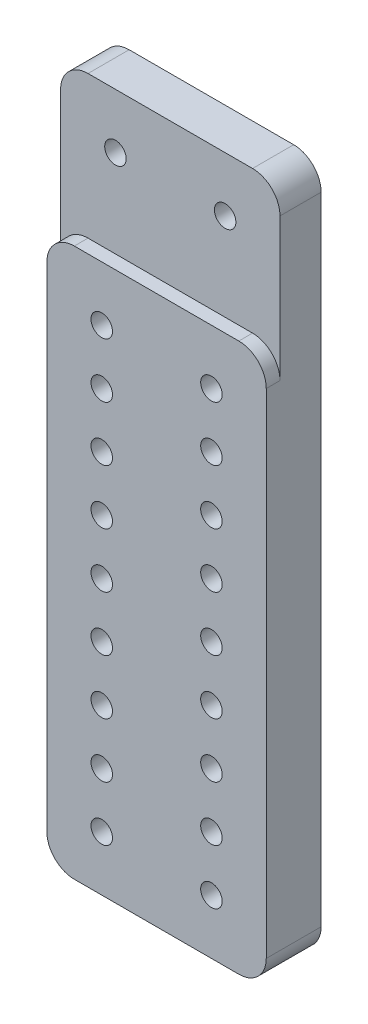
from build123d import *

# Parameters (mm, degrees)
SKETCH2_W           = 50.8
SKETCH2_H           = 160.02
BOSS_EXTRUDE1_DEPTH = 12.7
SKETCH3_R           = 2.4892
CUT_EXTRUDE1_DEPTH  = 169.369624339
FILLET1_R           = 6.35
SKETCH4_W           = 3.175
SKETCH4_H           = 33.02
CUT_EXTRUDE2_DEPTH  = 169.369624339
FILLET3_R           = 6.35


with BuildPart() as part:
    # Sketch2 → Boss-Extrude1 (new body)
    with BuildSketch(Plane.XY):
        with Locations((25.4, 80.01)):
            Rectangle(SKETCH2_W, SKETCH2_H)
    extrude(amount=-BOSS_EXTRUDE1_DEPTH)

    # Sketch3 → Cut-Extrude1 (cut, through all)
    with BuildSketch(Plane.XY):
        with Locations((12.7, 147.32)):
            Circle(SKETCH3_R)
        with Locations((38.1, 147.32)):
            Circle(SKETCH3_R)
        with Locations((12.7, 114.3)):
            Circle(SKETCH3_R)
        with Locations((12.7, 101.6)):
            Circle(SKETCH3_R)
        with Locations((12.7, 88.9)):
            Circle(SKETCH3_R)
        with Locations((12.7, 76.2)):
            Circle(SKETCH3_R)
        with Locations((12.7, 63.5)):
            Circle(SKETCH3_R)
        with Locations((38.1, 101.6)):
            Circle(SKETCH3_R)
        with Locations((38.1, 88.9)):
            Circle(SKETCH3_R)
        with Locations((38.1, 76.2)):
            Circle(SKETCH3_R)
        with Locations((38.1, 63.5)):
            Circle(SKETCH3_R)
        with Locations((38.1, 114.3)):
            Circle(SKETCH3_R)
        with Locations((12.7, 50.8)):
            Circle(SKETCH3_R)
        with Locations((12.7, 38.1)):
            Circle(SKETCH3_R)
        with Locations((12.7, 25.4)):
            Circle(SKETCH3_R)
        with Locations((12.7, 12.7)):
            Circle(SKETCH3_R)
        with Locations((38.1, 50.8)):
            Circle(SKETCH3_R)
        with Locations((38.1, 38.1)):
            Circle(SKETCH3_R)
        with Locations((38.1, 25.4)):
            Circle(SKETCH3_R)
        with Locations((38.1, 12.7)):
            Circle(SKETCH3_R)
    extrude(amount=-CUT_EXTRUDE1_DEPTH, mode=Mode.SUBTRACT)

    # Fillet1
    fillet1_edges = [part.edges().sort_by_distance(p)[0] for p in [
        (0, 160.02, -6.35),
        (50.8, 160.02, -6.35),
        (50.8, 0, -6.35),
        (0, 0, -6.35),
    ]]
    fillet(fillet1_edges, radius=FILLET1_R)

    # Sketch4 → Cut-Extrude2 (cut, through all)
    with BuildSketch(Plane.ZY):
        with Locations((-1.5875, 143.51)):
            Rectangle(SKETCH4_W, SKETCH4_H)
    extrude(amount=-CUT_EXTRUDE2_DEPTH, mode=Mode.SUBTRACT)

    # Fillet3
    fillet3_edges = [part.edges().sort_by_distance(p)[0] for p in [
        (0, 127, -1.5875),
        (50.8, 127, -1.5875),
    ]]
    fillet(fillet3_edges, radius=FILLET3_R)


solid = part.part
